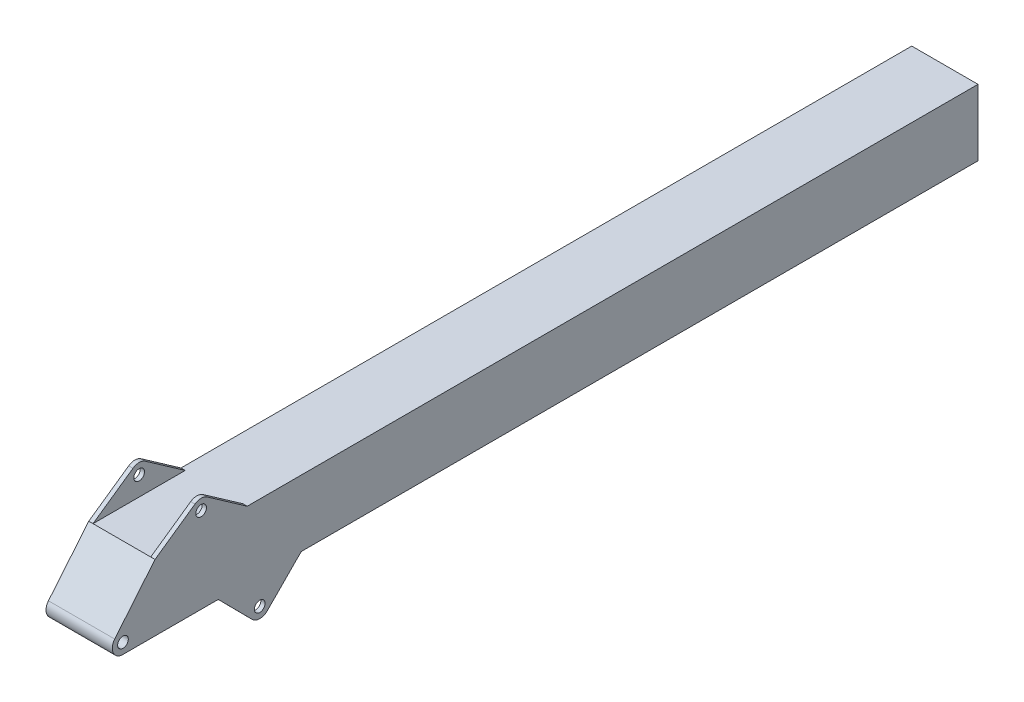
from build123d import *

# Parameters (mm, degrees)
SKETCH1_R           = 25
BOSS_EXTRUDE1_DEPTH = 310
SHELL1_T            = -20
BOSS_EXTRUDE3_REACH = 3867.524
SKETCH2_W           = 270
SKETCH2_H           = 270
SKETCH3_R           = 25
BOSS_EXTRUDE4_DEPTH = 20


with BuildPart() as part:
    # Sketch1 → Boss-Extrude1 (new body)
    with BuildSketch(Plane(origin=(0, 0, 0), x_dir=(0, 0, -1), z_dir=(1, 0, 0))):
        with BuildLine():
            Line((2000, 310), (2000, 0))
            Line((2000, 0), (-2000, 0))
            ThreePointArc((-2000, 0), (-2045.235839293, 28.699322933), (-2038.542160184, 81.85124626))
            Line((-2038.542160184, 81.85124626), (-1850, 310))
            Line((-1850, 310), (2000, 310))
        make_face()
        with Locations((-2000, 50)):
            Circle(SKETCH1_R, mode=Mode.SUBTRACT)
    extrude(amount=-BOSS_EXTRUDE1_DEPTH)

    # Shell1
    shell1_openings = [part.faces().sort_by_distance(p)[0] for p in [
        (-155, 155, -2000),
    ]]
    offset(amount=SHELL1_T, openings=shell1_openings, kind=Kind.INTERSECTION)

    # Sketch2 → Boss-Extrude3 (add, up to next)
    with BuildSketch(Plane(origin=(0, 0, 1840.58238892), x_dir=(1, 0, 0), z_dir=(0, 0, -1)), mode=Mode.PRIVATE) as boss_extrude3_sk1:
        with Locations((-155, -155)):
            Rectangle(SKETCH2_W, SKETCH2_H)
    boss_extrude3_tool1 = extrude(boss_extrude3_sk1.sketch, amount=-BOSS_EXTRUDE3_REACH, mode=Mode.PRIVATE) - part.part
    add(boss_extrude3_tool1.solids().sort_by_distance((-155, 155, 1840.582389))[0])

    # Sketch3 → Boss-Extrude4 (add)
    # profile 1 of 2: a face of its own
    with BuildSketch(Plane(origin=(0, 0, 0), x_dir=(0, 0, -1), z_dir=(1, 0, 0))):
        with BuildLine():
            Line((-1553.968883966, 0), (-1166.031116034, 0))
            Line((-1166.031116034, 0), (-1324.452009603, -160.161632196))
            ThreePointArc((-1324.452009603, -160.161632196), (-1360, -175), (-1395.547990397, -160.161632196))
            Line((-1395.547990397, -160.161632196), (-1553.968883966, 0))
        make_face()
        with Locations((-1360, -125)):
            Circle(SKETCH3_R, mode=Mode.SUBTRACT)
    # profile 2 of 2: a face of its own
    with BuildSketch(Plane(origin=(0, 0, 0), x_dir=(0, 0, -1), z_dir=(1, 0, 0))):
        with BuildLine():
            Line((-1850, 310), (-1662.97316143, 440.957602214))
            ThreePointArc((-1662.97316143, 440.957602214), (-1634.294339612, 450), (-1605.615517795, 440.957602214))
            Line((-1605.615517795, 440.957602214), (-1418.588679224, 310))
            Line((-1418.588679224, 310), (-1634.294339612, 310))
            Line((-1634.294339612, 310), (-1850, 310))
        make_face()
        with Locations((-1634.294339612, 400)):
            Circle(SKETCH3_R, mode=Mode.SUBTRACT)
    boss_extrude4 = extrude(amount=-BOSS_EXTRUDE4_DEPTH)

    # Mirror1: Boss-Extrude4 across plane
    add(boss_extrude4.mirror(Plane.ZY.offset(155)))


solid = part.part
